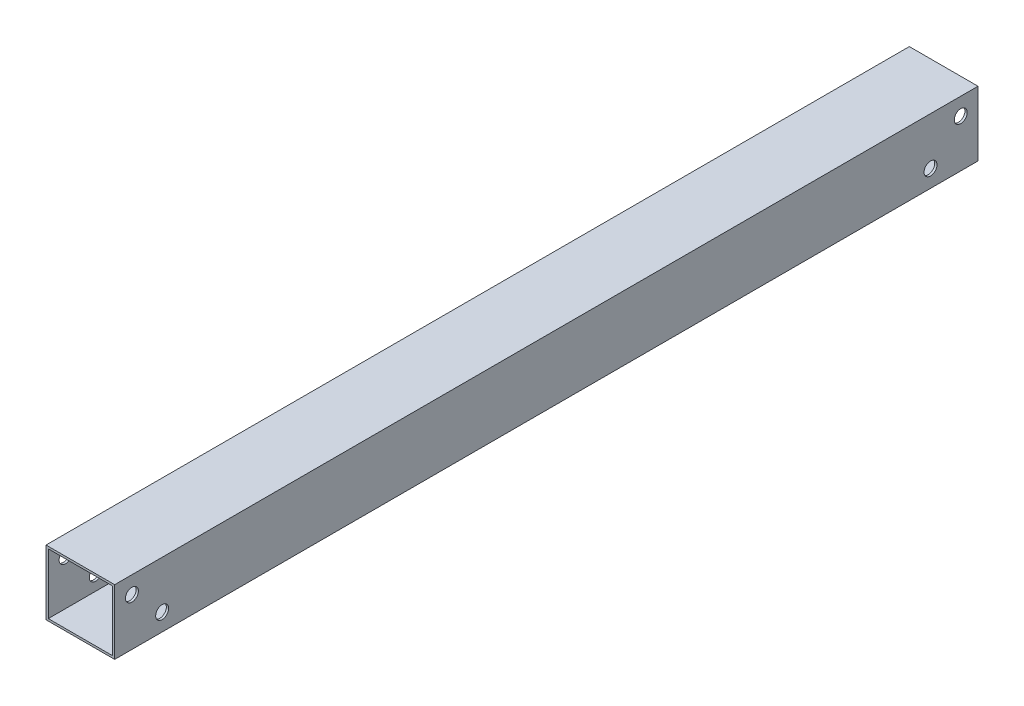
from build123d import *

# Parameters (mm, degrees)
ESQUISSE1_W             = 15.90910635
ESQUISSE1_H             = 15
ESQUISSE1_W_2           = 14.84849926
ESQUISSE1_H_2           = 14
BOSS_EXTRU_1_DEPTH      = 200
ESQUISSE6_R             = 1.5
ENL_V_MAT_EXTRU_7_DEPTH = 20


with BuildPart() as part:
    # Esquisse1 → Boss.-Extru.1 (new body)
    with BuildSketch(Plane.XY):
        with Locations((7.954553175, 7.5)):
            Rectangle(ESQUISSE1_W, ESQUISSE1_H)
        with Locations((7.954553175, 7.5)):
            Rectangle(ESQUISSE1_W_2, ESQUISSE1_H_2, mode=Mode.SUBTRACT)
    extrude(amount=-BOSS_EXTRU_1_DEPTH)

    # Esquisse6 → Enlèv. mat.-Extru.7 (cut)
    with BuildSketch(Plane(origin=(15.90910635, 0, 0), x_dir=(0, 0, -1), z_dir=(1, 0, 0))):
        with Locations(Location((4, 11, 0), (0, 0, 180))):
            Circle(ESQUISSE6_R)
        with Locations(Location((11, 4, 0), (0, 0, 180))):
            Circle(ESQUISSE6_R)
        with Locations(Location((189, 4, 0), (0, 0, 180))):
            Circle(ESQUISSE6_R)
        with Locations(Location((196, 11, 0), (0, 0, 180))):
            Circle(ESQUISSE6_R)
    extrude(amount=-ENL_V_MAT_EXTRU_7_DEPTH, mode=Mode.SUBTRACT)


solid = part.part
